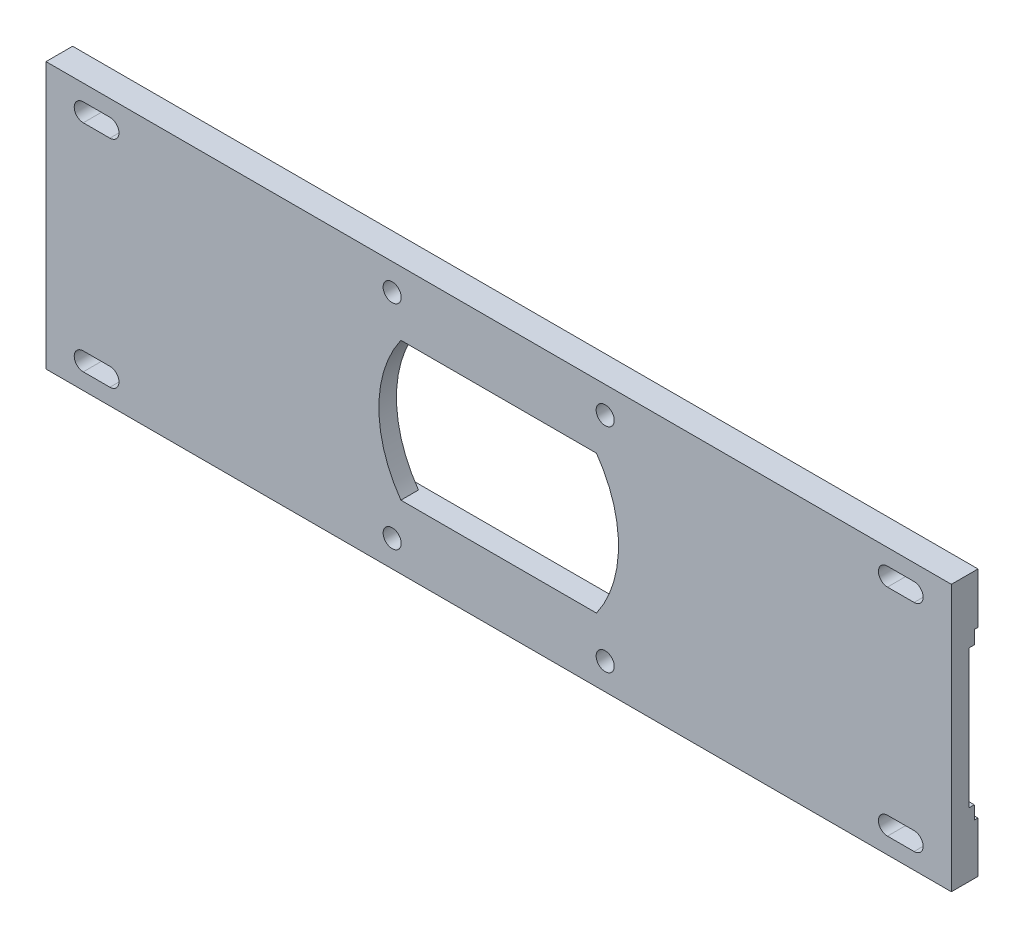
from build123d import *

# Parameters (mm, degrees)
SZKIC1_W                    = 170
SZKIC1_H                    = 50
DODANIE_WYCI_GNI_CIE1_DEPTH = 5
SZKIC2_W                    = 0.7
SZKIC2_H                    = 31
WYTNIJ_WYCI_GNI_CIE1_DEPTH  = 173.234529168
SZKIC3_W                    = 1
SZKIC3_H                    = 26
WYTNIJ_WYCI_GNI_CIE2_DEPTH  = 173.234529168
SZKIC4_R                    = 1.7
WYTNIJ_WYCI_GNI_CIE3_DEPTH  = 101.51922361
SZKIC5_R                    = 22.5
WYTNIJ_WYCI_GNI_CIE4_DEPTH  = 10
WYTNIJ_WYCI_GNI_CIE5_DEPTH  = 101.51922361
LUSTRO2_COPY_1_DEPTH        = 101.51922361
SZKIC7_W                    = 32.832404509
SZKIC7_H                    = 9.5
DODANIE_WYCI_GNI_CIE2_DEPTH = 5
SZKIC8_W                    = 34.236470266
SZKIC8_H                    = 9.5
DODANIE_WYCI_GNI_CIE3_DEPTH = 5
SZKIC9_W                    = 39.464340028
SZKIC9_H                    = 2.5
DODANIE_WYCI_GNI_CIE4_DEPTH = 4.3
SZKIC10_W                   = 39.512976603
SZKIC10_H                   = 2.5
DODANIE_WYCI_GNI_CIE5_DEPTH = 4.3


with BuildPart() as part:
    # Szkic1 → Dodanie-wyciągnięcie1 (new body)
    with BuildSketch(Plane.XY):
        with Locations((11.640474324, -2.198033708)):
            Rectangle(SZKIC1_W, SZKIC1_H)
    extrude(amount=DODANIE_WYCI_GNI_CIE1_DEPTH)

    # Szkic2 → Wytnij-wyciągnięcie1 (cut, through all)
    with BuildSketch(Plane.ZY.offset(73.359525676)):
        with Locations((0.35, -2.198033708)):
            Rectangle(SZKIC2_W, SZKIC2_H)
    extrude(amount=-WYTNIJ_WYCI_GNI_CIE1_DEPTH, mode=Mode.SUBTRACT)

    # Szkic3 → Wytnij-wyciągnięcie2 (cut, through all)
    with BuildSketch(Plane.ZY.offset(73.359525676)):
        with Locations((1.2, -2.198033708)):
            Rectangle(SZKIC3_W, SZKIC3_H)
    extrude(amount=-WYTNIJ_WYCI_GNI_CIE2_DEPTH, mode=Mode.SUBTRACT)

    # Szkic4 → Wytnij-wyciągnięcie3 (cut, through all)
    with BuildSketch(Plane.XY.offset(5)):
        with Locations((-8.359525676, -22.198033708)):
            Circle(SZKIC4_R)
        with Locations((31.640474324, -22.198033708)):
            Circle(SZKIC4_R)
        with Locations((31.640474324, 17.801966292)):
            Circle(SZKIC4_R)
        with Locations((-8.359525676, 17.801966292)):
            Circle(SZKIC4_R)
    extrude(amount=-WYTNIJ_WYCI_GNI_CIE3_DEPTH, mode=Mode.SUBTRACT)

    # Szkic5 → Wytnij-wyciągnięcie4 (cut)
    with BuildSketch(Plane.XY.offset(5)):
        with Locations((11.640474324, -2.198033708)):
            Circle(SZKIC5_R)
    extrude(amount=-WYTNIJ_WYCI_GNI_CIE4_DEPTH, mode=Mode.SUBTRACT)

    # Szkic6 → Wytnij-wyciągnięcie5 (cut, through all)
    with BuildSketch(Plane(origin=(0, 0, 0), x_dir=(-1, 0, 0), z_dir=(0, 0, -1))):
        with BuildLine():
            Line((66.359525676, 19.751966292), (61.359525676, 19.751966292))
            ThreePointArc((61.359525676, 19.751966292), (59.659525676, 18.051966292), (61.359525676, 16.351966292))
            Line((61.359525676, 16.351966292), (66.359525676, 16.351966292))
            ThreePointArc((66.359525676, 16.351966292), (68.059525676, 18.051966292), (66.359525676, 19.751966292))
        make_face()
    wytnij_wyci_gni_cie5 = extrude(amount=-WYTNIJ_WYCI_GNI_CIE5_DEPTH, mode=Mode.SUBTRACT)

    # Lustro1: Wytnij-wyciągnięcie5 across plane
    add(wytnij_wyci_gni_cie5.mirror(Plane(origin=(0, -2.198033708, 0), x_dir=(0, 0, 1), z_dir=(0, -1, 0))), mode=Mode.SUBTRACT)

    # Lustro2: Wytnij-wyciągnięcie5 across plane
    add(wytnij_wyci_gni_cie5.mirror(Plane(origin=(11.640474324, 0, 0), x_dir=(0, 0, 1), z_dir=(1, 0, 0))), mode=Mode.SUBTRACT)

    # Lustro2 copy 1 sketch → Lustro2 copy 1 (cut, through all)
    with BuildSketch(Plane(origin=(23.280948648, -4.396067416, 0), x_dir=(1, 0, 0), z_dir=(0, 0, -1))):
        with BuildLine():
            Line((66.359525676, 19.751966292), (61.359525676, 19.751966292))
            ThreePointArc((61.359525676, 19.751966292), (59.659525676, 18.051966292), (61.359525676, 16.351966292))
            Line((61.359525676, 16.351966292), (66.359525676, 16.351966292))
            ThreePointArc((66.359525676, 16.351966292), (68.059525676, 18.051966292), (66.359525676, 19.751966292))
        make_face()
    extrude(amount=-LUSTRO2_COPY_1_DEPTH, mode=Mode.SUBTRACT)

    # Szkic7 → Dodanie-wyciągnięcie2 (add, through all)
    with BuildSketch(Plane(origin=(0, 0, 0), x_dir=(-1, 0, 0), z_dir=(0, 0, -1))):
        with Locations((-11.5337785, 18.051966292)):
            Rectangle(SZKIC7_W, SZKIC7_H)
    extrude(amount=-DODANIE_WYCI_GNI_CIE2_DEPTH)

    # Szkic8 → Dodanie-wyciągnięcie3 (add, through all)
    with BuildSketch(Plane(origin=(0, 0, 0), x_dir=(-1, 0, 0), z_dir=(0, 0, -1))):
        with Locations((-10.831745621, -22.448033708)):
            Rectangle(SZKIC8_W, SZKIC8_H)
    extrude(amount=-DODANIE_WYCI_GNI_CIE3_DEPTH)

    # Szkic9 → Dodanie-wyciągnięcie4 (add, through all)
    with BuildSketch(Plane(origin=(0, 0, 0.7), x_dir=(-1, 0, 0), z_dir=(0, 0, -1))):
        with Locations((-10.272671982, 12.051966292)):
            Rectangle(SZKIC9_W, SZKIC9_H)
    extrude(amount=-DODANIE_WYCI_GNI_CIE4_DEPTH)

    # Szkic10 → Dodanie-wyciągnięcie5 (add, through all)
    with BuildSketch(Plane(origin=(0, 0, 0.7), x_dir=(-1, 0, 0), z_dir=(0, 0, -1))):
        with Locations((-10.248353695, -16.448033708)):
            Rectangle(SZKIC10_W, SZKIC10_H)
    extrude(amount=-DODANIE_WYCI_GNI_CIE5_DEPTH)


solid = part.part
